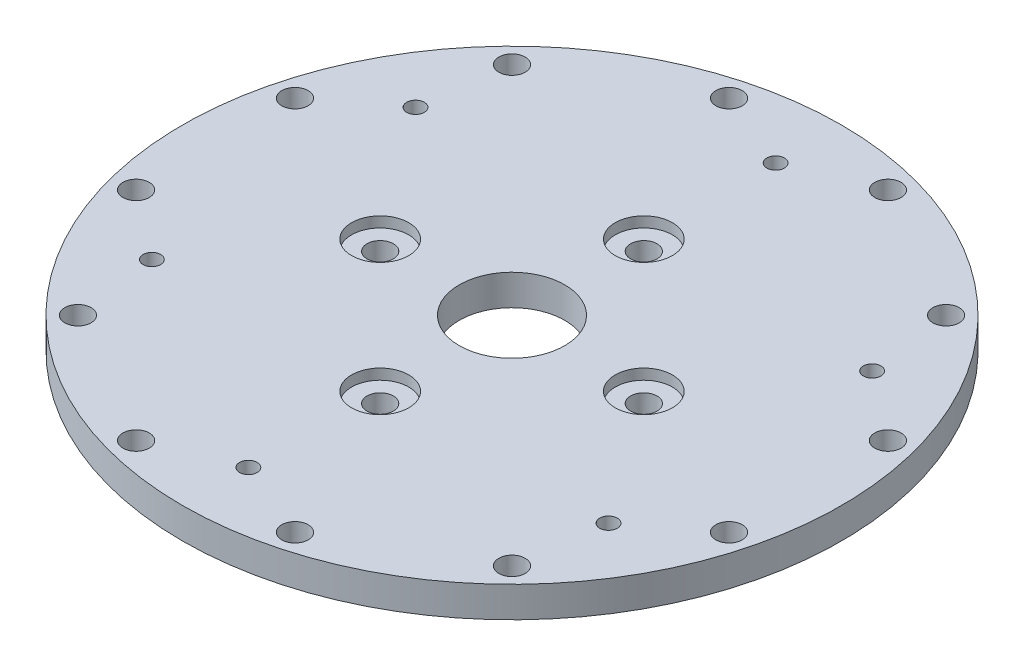
from build123d import *

# Parameters (mm, degrees)
SKETCH1_R           = 37.5
SKETCH1_R_2         = 6
SKETCH1_R_3         = 1.5
SKETCH1_R_4         = 1
BOSS_EXTRUDE1_DEPTH = 3.5
SKETCH2_R           = 3.25
CUT_EXTRUDE1_DEPTH  = 1.2


with BuildPart() as part:
    # Sketch1 → Boss-Extrude1 (new body)
    with BuildSketch(Plane(origin=(0, 0, 0), x_dir=(1, 0, 0), z_dir=(0, 1, 0))):
        with Locations(Location((0, 0, 0), (0, 0, 270))):
            Circle(SKETCH1_R)
        with Locations(Location((0, 0, 0), (0, 0, 270))):
            Circle(SKETCH1_R_2, mode=Mode.SUBTRACT)
        with Locations(Location((0, 15, 0), (0, 0, 270))):
            Circle(SKETCH1_R_3, mode=Mode.SUBTRACT)
        with Locations(Location((15, 0, 0), (0, 0, 270))):
            Circle(SKETCH1_R_3, mode=Mode.SUBTRACT)
        with Locations(Location((0, -15, 0), (0, 0, 270))):
            Circle(SKETCH1_R_3, mode=Mode.SUBTRACT)
        with Locations(Location((-15, 0, 0), (0, 0, 270))):
            Circle(SKETCH1_R_3, mode=Mode.SUBTRACT)
        with Locations(Location((-33.737040436, -9.03981274, 0), (0, 0, 270))):
            Circle(SKETCH1_R_3, mode=Mode.SUBTRACT)
        with Locations(Location((-33.737040436, 9.03981274, 0), (0, 0, 270))):
            Circle(SKETCH1_R_3, mode=Mode.SUBTRACT)
        with Locations(Location((-24.697227696, 24.697227696, 0), (0, 0, 270))):
            Circle(SKETCH1_R_3, mode=Mode.SUBTRACT)
        with Locations(Location((-9.03981274, 33.737040436, 0), (0, 0, 270))):
            Circle(SKETCH1_R_3, mode=Mode.SUBTRACT)
        with Locations(Location((9.03981274, 33.737040436, 0), (0, 0, 270))):
            Circle(SKETCH1_R_3, mode=Mode.SUBTRACT)
        with Locations(Location((24.697227696, 24.697227696, 0), (0, 0, 270))):
            Circle(SKETCH1_R_3, mode=Mode.SUBTRACT)
        with Locations(Location((33.737040436, 9.03981274, 0), (0, 0, 270))):
            Circle(SKETCH1_R_3, mode=Mode.SUBTRACT)
        with Locations(Location((33.737040436, -9.03981274, 0), (0, 0, 270))):
            Circle(SKETCH1_R_3, mode=Mode.SUBTRACT)
        with Locations(Location((24.697227696, -24.697227696, 0), (0, 0, 270))):
            Circle(SKETCH1_R_3, mode=Mode.SUBTRACT)
        with Locations(Location((9.03981274, -33.737040436, 0), (0, 0, 270))):
            Circle(SKETCH1_R_3, mode=Mode.SUBTRACT)
        with Locations(Location((-9.03981274, -33.737040436, 0), (0, 0, 270))):
            Circle(SKETCH1_R_3, mode=Mode.SUBTRACT)
        with Locations(Location((-24.697227696, -24.697227696, 0), (0, 0, 270))):
            Circle(SKETCH1_R_3, mode=Mode.SUBTRACT)
        with Locations(Location((0, 30, 0), (0, 0, 270))):
            Circle(SKETCH1_R_4, mode=Mode.SUBTRACT)
        with Locations(Location((25.980762114, 15, 0), (0, 0, 270))):
            Circle(SKETCH1_R_4, mode=Mode.SUBTRACT)
        with Locations(Location((25.980762114, -15, 0), (0, 0, 270))):
            Circle(SKETCH1_R_4, mode=Mode.SUBTRACT)
        with Locations(Location((0, -30, 0), (0, 0, 270))):
            Circle(SKETCH1_R_4, mode=Mode.SUBTRACT)
        with Locations(Location((-25.980762114, -15, 0), (0, 0, 270))):
            Circle(SKETCH1_R_4, mode=Mode.SUBTRACT)
        with Locations(Location((-25.980762114, 15, 0), (0, 0, 270))):
            Circle(SKETCH1_R_4, mode=Mode.SUBTRACT)
    extrude(amount=BOSS_EXTRUDE1_DEPTH)

    # Sketch2 → Cut-Extrude1 (cut)
    with BuildSketch(Plane(origin=(0, 3.5, 0), x_dir=(1, 0, 0), z_dir=(0, 1, 0))):
        with Locations(Location((0, 15, 0), (0, 0, 270))):
            Circle(SKETCH2_R)
        with Locations(Location((15, 0, 0), (0, 0, 270))):
            Circle(SKETCH2_R)
        with Locations(Location((0, -15, 0), (0, 0, 270))):
            Circle(SKETCH2_R)
        with Locations(Location((-15, 0, 0), (0, 0, 270))):
            Circle(SKETCH2_R)
    extrude(amount=-CUT_EXTRUDE1_DEPTH, mode=Mode.SUBTRACT)


solid = part.part
